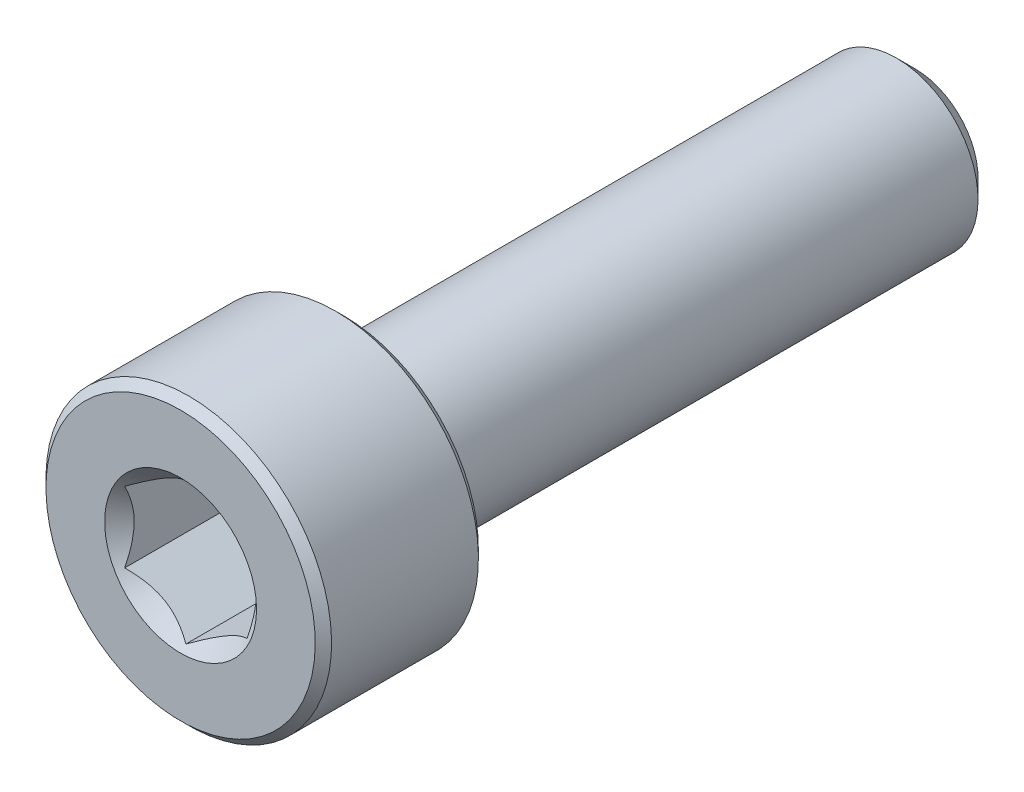
from build123d import *

# Parameters (mm, degrees)
CUT_EXTRUDE1_DEPTH = 3


with BuildPart() as part:
    # Sketch2 → Revolve1 (revolve)
    with BuildSketch(Plane(origin=(0, 0, 0), x_dir=(0, 0, -1), z_dir=(1, 0, 0))):
        with BuildLine():
            Line((-9, 0), (-9, 3.3))
            Line((-9, 3.3), (-8.8, 3.5))
            Line((-8.8, 3.5), (-5.2, 3.5))
            Line((-5.2, 3.5), (-5, 3.3))
            Line((-5, 3.3), (-5, 2.2))
            ThreePointArc((-5, 2.2), (-4.941421356, 2.058578644), (-4.8, 2))
            Line((-4.8, 2), (8.545336663, 2))
            Line((8.545336663, 2), (9, 1.545336663))
            Line((9, 1.545336663), (9, 0))
            Line((9, 0), (-9, 0))
        make_face()
    revolve(axis=Axis((0, 0, -9), (0, 0, 1)))

    # Sketch3 → Cut-Extrude1 (cut)
    with BuildSketch(Plane.XY.offset(9)):
        Polygon((1.5, -0.866025404), (1.5, 0.866025404), (0, 1.732050808), (-1.5, 0.866025404), (-1.5, -0.866025404), (0, -1.732050808), align=None)
    extrude(amount=-CUT_EXTRUDE1_DEPTH, mode=Mode.SUBTRACT)

    # Cut-Extrude2 cone 1 section (through the dimple's axis) → Cut-Extrude2 (revolve, cut)
    with BuildSketch(Plane(origin=(0, 0, 9), x_dir=(0, -1, 0), z_dir=(1, 0, 0))):
        Polygon((0, 0), (1.861954618, 0), (0, 1.861954618), align=None)
    revolve(axis=Axis((0, 0, 9), (0, 0, -1)), mode=Mode.SUBTRACT)


solid = part.part
